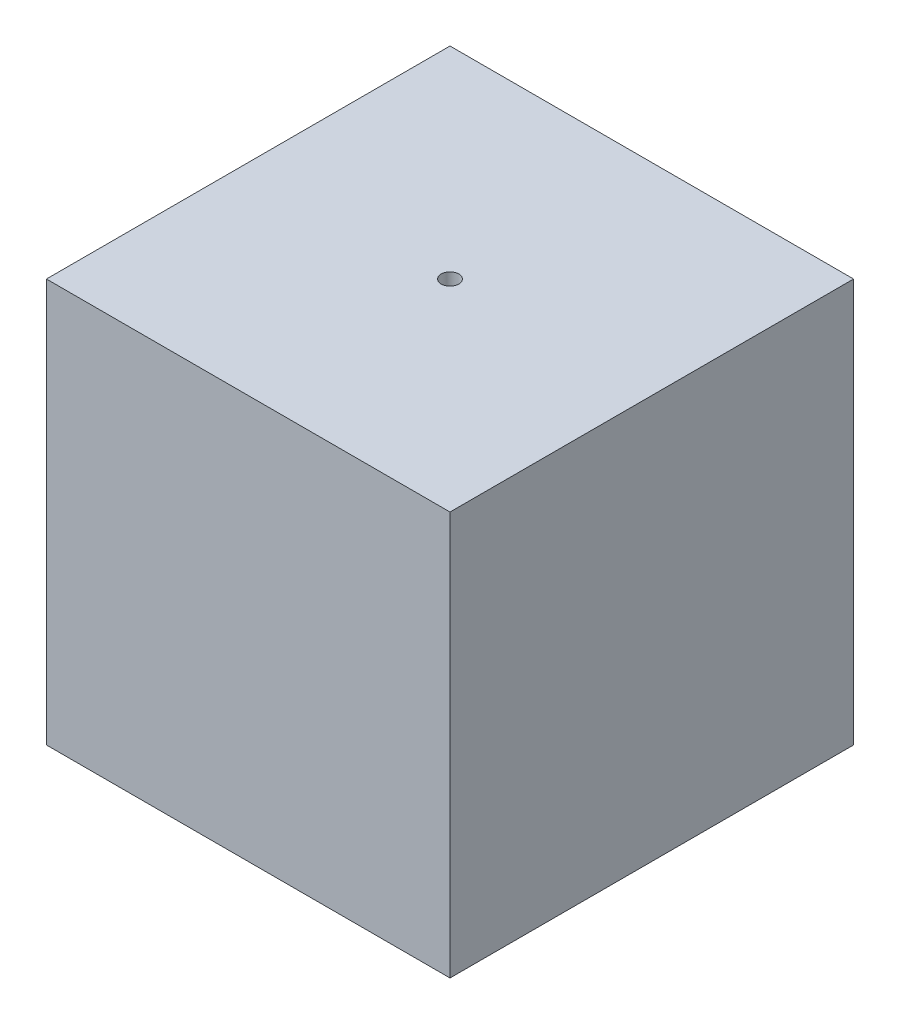
from build123d import *

# Parameters (mm, degrees)
CROQUIS1_W              = 230
CROQUIS1_H              = 230
SALIENTE_EXTRUIR1_DEPTH = 230
CROQUIS2_R              = 5
CORTAR_EXTRUIR1_DEPTH   = 10


with BuildPart() as part:
    # Croquis1 → Saliente-Extruir1 (new body)
    with BuildSketch(Plane(origin=(0, 0, 0), x_dir=(1, 0, 0), z_dir=(0, 1, 0))):
        with Locations((115, 115)):
            Rectangle(CROQUIS1_W, CROQUIS1_H)
    extrude(amount=SALIENTE_EXTRUIR1_DEPTH)

    # Croquis2 → Cortar-Extruir1 (cut)
    with BuildSketch(Plane(origin=(0, 230, 0), x_dir=(1, 0, 0), z_dir=(0, 1, 0))):
        with Locations(Location((115, 115, 0), (0, 0, 270))):
            Circle(CROQUIS2_R)
    extrude(amount=-CORTAR_EXTRUIR1_DEPTH, mode=Mode.SUBTRACT)


solid = part.part
